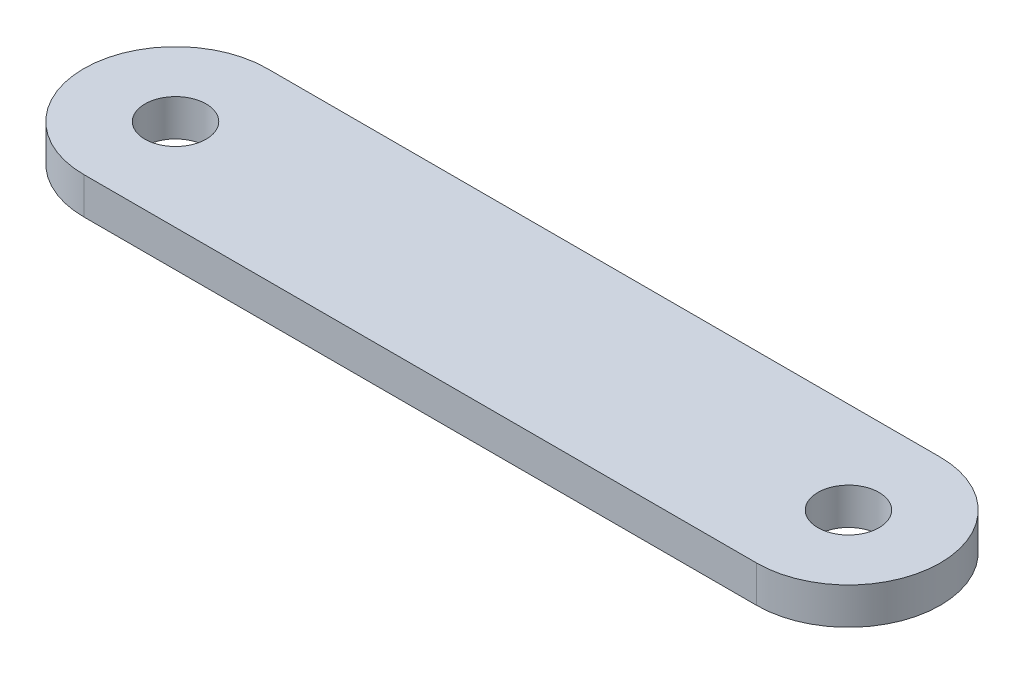
from build123d import *

# Parameters (mm, degrees)
SKETCH2_R           = 5
BOSS_EXTRUDE1_DEPTH = 6


with BuildPart() as part:
    # Sketch2 → Boss-Extrude1 (new body)
    with BuildSketch(Plane(origin=(0, 0, 0), x_dir=(1, 0, 0), z_dir=(0, 1, 0))):
        with BuildLine():
            Line((-45, 15), (65, 15))
            ThreePointArc((65, 15), (80, 0), (65, -15))
            Line((65, -15), (-45, -15))
            ThreePointArc((-45, -15), (-60, 0), (-45, 15))
        make_face()
        with Locations(Location((-45, 0, 0), (0, 0, 270))):
            Circle(SKETCH2_R, mode=Mode.SUBTRACT)
        with Locations(Location((65, 0, 0), (0, 0, 270))):
            Circle(SKETCH2_R, mode=Mode.SUBTRACT)
    extrude(amount=BOSS_EXTRUDE1_DEPTH)


solid = part.part
